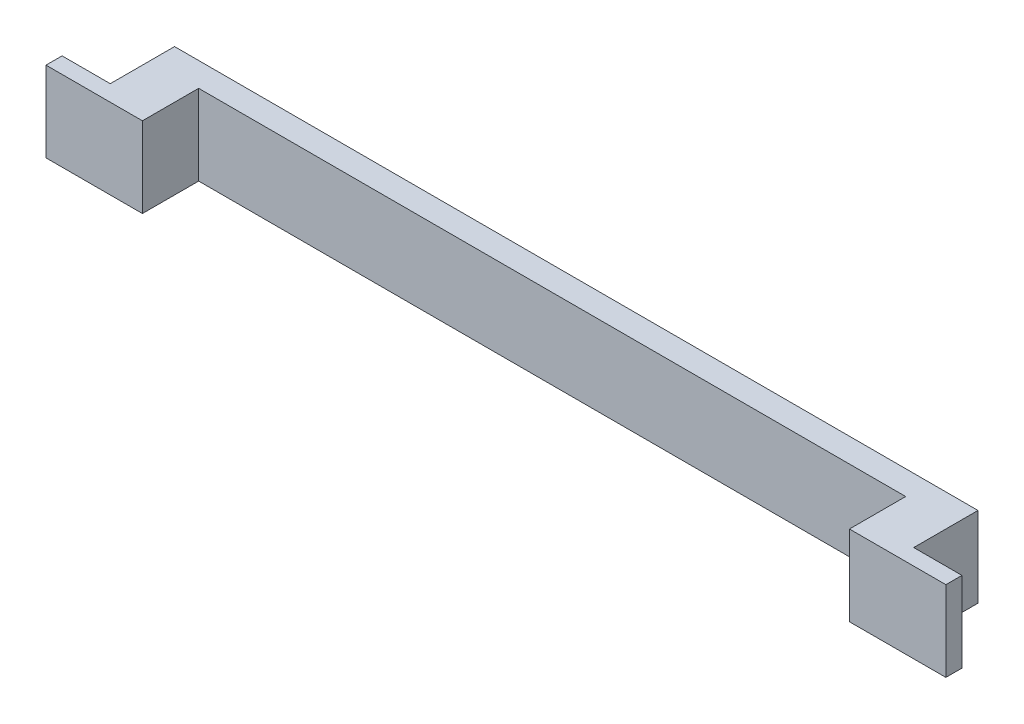
from build123d import *

# Parameters (mm, degrees)
BOSS_EXTRUDE1_DEPTH = 5
SKETCH2_W           = 6
SKETCH2_H           = 5
BOSS_EXTRUDE2_DEPTH = 1


with BuildPart() as part:
    # Sketch1 → Boss-Extrude1 (new body)
    with BuildSketch(Plane(origin=(0, 0, 0), x_dir=(1, 0, 0), z_dir=(0, 1, 0))):
        Polygon((-22, -1), (22, -1), (22, -4.5), (25, -4.5), (25, -0.5), (25, 0.5), (-25, 0.5), (-25, -0.5), (-25, -4.5), (-22, -4.5), align=None)
    extrude(amount=BOSS_EXTRUDE1_DEPTH)

    # Sketch2 → Boss-Extrude2 (add)
    with BuildSketch(Plane.XY.offset(4.5)):
        with Locations((-25, 2.5)):
            Rectangle(SKETCH2_W, SKETCH2_H)
    boss_extrude2 = extrude(amount=-BOSS_EXTRUDE2_DEPTH)

    # Mirror1: Boss-Extrude2 across plane
    add(boss_extrude2.mirror(Plane(origin=(0, 0, 0), x_dir=(0, 0, 1), z_dir=(1, 0, 0))))


solid = part.part
